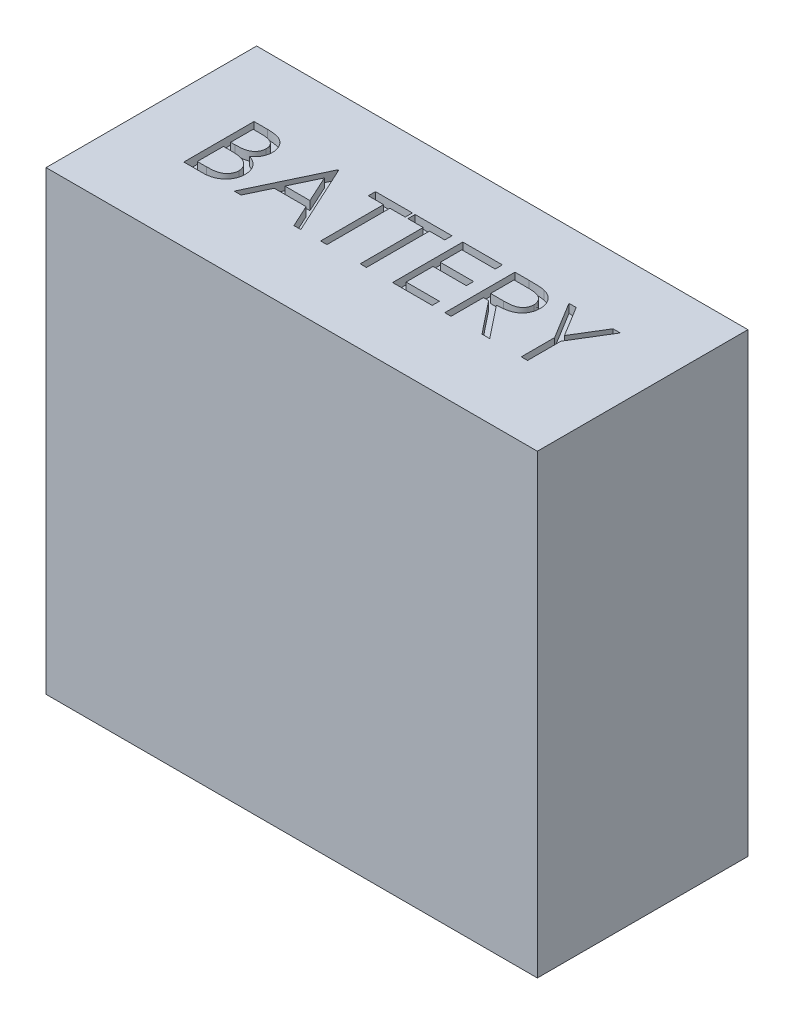
from build123d import *

# Parameters (mm, degrees)
SKETCH2_W           = 177.8
SKETCH2_H           = 165.1
BOSS_EXTRUDE1_DEPTH = 76.2
CUT_EXTRUDE1_DEPTH  = 3.175


with BuildPart() as part:
    # Sketch2 → Boss-Extrude1 (new body)
    with BuildSketch(Plane.XY):
        Rectangle(SKETCH2_W, SKETCH2_H)
    extrude(amount=BOSS_EXTRUDE1_DEPTH)

    # Sketch3 → Cut-Extrude1 (cut)
    # profile 1 of 7: a face of its own
    with BuildSketch(Plane(origin=(0, 82.55, 0), x_dir=(1, 0, 0), z_dir=(0, 1, 0))):
        with BuildLine():
            Line((-65.712217331, -24.131786217), (-60.756367972, -24.131786217))
            add(Edge.make_bspline(
                [(-60.756367972, -24.131786217), (-60.513772731, -24.133061662), (-60.043562776, -24.135533794), (-59.359798826, -24.173874231), (-58.719364601, -24.226152293), (-58.122074367, -24.309102108), (-57.568204127, -24.409191005), (-57.056084702, -24.53039847), (-56.587344595, -24.675734466), (-56.027726451, -24.906847479), (-55.389673655, -25.250278472), (-54.698805319, -25.757760059), (-54.108043125, -26.378481363), (-53.598690994, -27.078669776), (-53.193734297, -27.848912234), (-52.90076854, -28.670850347), (-52.715291387, -29.533882417), (-52.696216464, -30.126378622), (-52.686576306, -30.425816665)],
                knots=[0, 0, 0, 0, 1.001505555, 1.941167018, 2.826882275, 3.653841531, 4.429895133, 5.150066043, 5.825578002, 6.45369114, 7.647487171, 8.808567382, 9.977351308, 11.170798116, 12.373658725, 13.556498008, 14.765093433, 16, 16, 16, 16], degree=3))
            add(Edge.make_bspline(
                [(-52.686576306, -30.425816665), (-52.694509948, -30.706323784), (-52.710100304, -31.257546724), (-52.859182043, -32.063772546), (-53.092576608, -32.831224248), (-53.417008988, -33.557100988), (-53.838663474, -34.225002066), (-54.33837813, -34.840315369), (-54.941278354, -35.376988754), (-55.392986438, -35.677020104), (-55.622433677, -35.829422435)],
                knots=[0, 0, 0, 0, 1.044552857, 2.05264487, 3.044412934, 4.028983338, 5.005914585, 5.980388656, 6.974128949, 8, 8, 8, 8], degree=3))
            add(Edge.make_bspline(
                [(-55.622433677, -35.829422435), (-55.333886574, -35.940202713), (-54.781824488, -36.152152827), (-54.02210314, -36.526878765), (-53.367546265, -36.934455224), (-52.813121263, -37.379549222), (-52.338956567, -37.859310306), (-51.92491522, -38.380773135), (-51.571627533, -38.950740121), (-51.268910888, -39.563268635), (-51.032699915, -40.212104148), (-50.855800495, -40.891160637), (-50.754436721, -41.598003123), (-50.740012125, -42.079045591), (-50.732730152, -42.321890383)],
                knots=[0, 0, 0, 0, 1.27268992, 2.434971085, 3.483601985, 4.442670788, 5.356604649, 6.2567628, 7.179492994, 8.113709626, 9.066344395, 10.018646069, 10.999752585, 12, 12, 12, 12], degree=3))
            add(Edge.make_bspline(
                [(-50.732730152, -42.321890383), (-50.739819263, -42.569844255), (-50.753767288, -43.057700445), (-50.856673369, -43.774380564), (-51.030910888, -44.459273034), (-51.270912922, -45.116807788), (-51.584148005, -45.745712764), (-51.965350946, -46.346700452), (-52.419877151, -46.913732451), (-52.928333399, -47.453109601), (-53.503550112, -47.938088401), (-54.124150162, -48.370002387), (-54.79794917, -48.725210952), (-55.513880783, -49.023595793), (-56.279976106, -49.251522319), (-57.092795028, -49.410980427), (-57.951636533, -49.518422696), (-58.540987298, -49.527256125), (-58.843226947, -49.531786217)],
                knots=[0, 0, 0, 0, 0.978564426, 1.925352924, 2.850884081, 3.763762016, 4.682927383, 5.618979971, 6.567305752, 7.547517671, 8.540179244, 9.531824382, 10.526200242, 11.540722885, 12.589160233, 13.674978461, 14.80764778, 16, 16, 16, 16], degree=3))
            Line((-58.843226947, -49.531786217), (-65.712217331, -49.531786217))
            Line((-65.712217331, -49.531786217), (-65.712217331, -24.131786217))
        make_face()
        with BuildLine():
            Line((-63.432730152, -26.736914422), (-63.432730152, -34.877940063))
            Line((-63.432730152, -34.877940063), (-61.901199703, -34.877940063))
            add(Edge.make_bspline(
                [(-61.901199703, -34.877940063), (-61.677325588, -34.875037764), (-61.244755175, -34.869429932), (-60.618319355, -34.853366123), (-60.036840651, -34.808386036), (-59.501322777, -34.763418877), (-59.012609041, -34.690306156), (-58.57178216, -34.603277606), (-58.171923771, -34.511235952), (-57.710808212, -34.354703105), (-57.187764529, -34.123362262), (-56.630175716, -33.76433808), (-56.138616993, -33.336715631), (-55.723528831, -32.843295508), (-55.383811302, -32.299980902), (-55.147854626, -31.715440684), (-54.987854336, -31.104243155), (-54.973401508, -30.684647834), (-54.966063485, -30.471609935)],
                knots=[0, 0, 0, 0, 1.156816544, 2.235205308, 3.236616184, 4.169592532, 5.011045266, 5.787822928, 6.49130361, 7.128639758, 8.301311294, 9.436451833, 10.541879658, 11.654887649, 12.756523258, 13.837046038, 14.901820046, 16, 16, 16, 16], degree=3))
            add(Edge.make_bspline(
                [(-54.966063485, -30.471609935), (-54.96988205, -30.330634336), (-54.977372582, -30.054095304), (-55.038719406, -29.650965705), (-55.142986947, -29.27182533), (-55.276912389, -28.911478358), (-55.464064587, -28.581192359), (-55.684416578, -28.269547453), (-55.950649873, -27.98715665), (-56.253688656, -27.723218005), (-56.602094091, -27.489214861), (-56.995658323, -27.284267608), (-57.439706036, -27.119234543), (-57.926753613, -26.974700179), (-58.464298076, -26.873185133), (-59.046136264, -26.788614834), (-59.677033939, -26.745560077), (-60.11351554, -26.739860587), (-60.339140408, -26.736914422)],
                knots=[0, 0, 0, 0, 0.91205012, 1.789085906, 2.630437955, 3.453916878, 4.269457761, 5.079663411, 5.91843418, 6.774407191, 7.675494373, 8.627863946, 9.638891023, 10.736472738, 11.911756761, 13.175263542, 14.539845004, 16, 16, 16, 16], degree=3))
            Line((-60.339140408, -26.736914422), (-63.432730152, -26.736914422))
        make_face(mode=Mode.SUBTRACT)
        with BuildLine():
            Line((-63.432730152, -37.483068268), (-63.432730152, -46.926658011))
            Line((-63.432730152, -46.926658011), (-60.186496177, -46.926658011))
            add(Edge.make_bspline(
                [(-60.186496177, -46.926658011), (-59.954130258, -46.923873102), (-59.506275581, -46.918505556), (-58.859655226, -46.900982788), (-58.260337844, -46.861124559), (-57.71105823, -46.798380393), (-57.205885231, -46.730319647), (-56.750879043, -46.63879778), (-56.342351297, -46.533939609), (-55.86864632, -46.371857331), (-55.33522086, -46.120060085), (-54.76037636, -45.74040827), (-54.249283234, -45.288119122), (-53.815267924, -44.764654774), (-53.459573664, -44.19546743), (-53.200816933, -43.592069747), (-53.041226144, -42.96443192), (-53.021906402, -42.536502063), (-53.012217331, -42.321890383)],
                knots=[0, 0, 0, 0, 1.160039823, 2.235823828, 3.228722157, 4.157150951, 4.99529583, 5.772374946, 6.472645482, 7.099169577, 8.269452708, 9.405989375, 10.527446681, 11.663510218, 12.788923519, 13.866172445, 14.929861265, 16, 16, 16, 16], degree=3))
            add(Edge.make_bspline(
                [(-53.012217331, -42.321890383), (-53.01422106, -42.187681569), (-53.018196197, -41.921428741), (-53.078144659, -41.530153939), (-53.165331029, -41.151143316), (-53.278044863, -40.783367714), (-53.442197567, -40.433476354), (-53.633833637, -40.094549207), (-53.858524952, -39.766138242), (-54.208639755, -39.350940746), (-54.717887872, -38.872571567), (-55.441474185, -38.404213693), (-56.264233147, -38.026495322), (-56.86096981, -37.866116265), (-57.169228549, -37.783268588)],
                knots=[0, 0, 0, 0, 0.723448775, 1.435228256, 2.130040452, 2.821711965, 3.505591119, 4.210454504, 4.921174351, 5.648778258, 7.137944449, 8.670945889, 10.280296675, 12, 12, 12, 12], degree=3))
            add(Edge.make_bspline(
                [(-57.169228549, -37.783268588), (-57.292811131, -37.758194551), (-57.560763658, -37.703828865), (-57.99769867, -37.646441531), (-58.49652469, -37.595314525), (-59.058393571, -37.55749641), (-59.684016189, -37.518405494), (-60.374728685, -37.503203078), (-61.12771034, -37.48506559), (-61.650169271, -37.483751073), (-61.921552267, -37.483068268)],
                knots=[0, 0, 0, 0, 0.634451884, 1.375622551, 2.216452059, 3.157844607, 4.20941857, 5.370758133, 6.634282058, 8, 8, 8, 8], degree=3))
            Line((-61.921552267, -37.483068268), (-63.432730152, -37.483068268))
        make_face(mode=Mode.SUBTRACT)
    # profile 2 of 7: a face of its own
    with BuildSketch(Plane(origin=(0, 82.55, 0), x_dir=(1, 0, 0), z_dir=(0, 1, 0))):
        Polygon((-35.101960921, -24.131786217), (-23.378883998, -49.531786217), (-25.856808677, -49.531786217), (-29.611856754, -41.390760576), (-41.126319895, -41.390760576), (-44.988218934, -49.531786217), (-47.476319895, -49.531786217), (-35.427601947, -24.131786217), align=None)
        Polygon((-35.290222139, -29.082547435), (-39.889901626, -38.78563237), (-30.812658036, -38.78563237), align=None, mode=Mode.SUBTRACT)
    # profile 3 of 7: a face of its own
    with BuildSketch(Plane(origin=(0, 82.55, 0), x_dir=(1, 0, 0), z_dir=(0, 1, 0))):
        Polygon((-21.75067887, -26.736914422), (-21.75067887, -24.131786217), (-8.399396818, -24.131786217), (-8.399396818, -26.736914422), (-13.935294254, -26.736914422), (-13.935294254, -49.531786217), (-16.214781434, -49.531786217), (-16.214781434, -26.736914422), align=None)
    # profile 4 of 7: a face of its own
    with BuildSketch(Plane(origin=(0, 82.55, 0), x_dir=(1, 0, 0), z_dir=(0, 1, 0))):
        Polygon((-7.422473742, -26.736914422), (-7.422473742, -24.131786217), (5.92880831, -24.131786217), (5.92880831, -26.736914422), (0.392910874, -26.736914422), (0.392910874, -49.531786217), (-1.886576306, -49.531786217), (-1.886576306, -26.736914422), align=None)
    # profile 5 of 7: a face of its own
    with BuildSketch(Plane(origin=(0, 82.55, 0), x_dir=(1, 0, 0), z_dir=(0, 1, 0))):
        Polygon((9.836500617, -24.131786217), (24.164705746, -24.131786217), (24.164705746, -26.736914422), (12.115987797, -26.736914422), (12.115987797, -34.552299037), (24.164705746, -34.552299037), (24.164705746, -37.157427242), (12.115987797, -37.157427242), (12.115987797, -46.926658011), (24.164705746, -46.926658011), (24.164705746, -49.531786217), (9.836500617, -49.531786217), align=None)
    # profile 6 of 7: a face of its own
    with BuildSketch(Plane(origin=(0, 82.55, 0), x_dir=(1, 0, 0), z_dir=(0, 1, 0))):
        with BuildLine():
            Line((28.723680105, -24.131786217), (33.806732989, -24.131786217))
            add(Edge.make_bspline(
                [(33.806732989, -24.131786217), (34.145940036, -24.132915326), (34.797255141, -24.135083342), (35.730329732, -24.147172022), (36.578160664, -24.181820203), (37.340304641, -24.21163678), (38.01674768, -24.266006869), (38.609564019, -24.317972708), (39.116023309, -24.385998703), (39.422607487, -24.449175201), (39.561420489, -24.477779806)],
                knots=[0, 0, 0, 0, 1.410062039, 2.707475311, 3.878576406, 4.937260626, 5.877586885, 6.699081471, 7.410979367, 8, 8, 8, 8], degree=3))
            add(Edge.make_bspline(
                [(39.561420489, -24.477779806), (39.747251419, -24.523694046), (40.114948999, -24.614543051), (40.64435805, -24.806564154), (41.14883343, -25.028775144), (41.626279583, -25.289769), (42.074305039, -25.591483116), (42.497529352, -25.928708919), (42.897873, -26.299601212), (43.259145402, -26.713511205), (43.599788806, -27.147753303), (43.887089124, -27.61731771), (44.134749863, -28.108347081), (44.331930186, -28.625835199), (44.490701765, -29.164763486), (44.602652188, -29.730013611), (44.669789378, -30.319010401), (44.676624558, -30.720750654), (44.680090361, -30.924454486)],
                knots=[0, 0, 0, 0, 1.027469482, 2.033020251, 3.019912614, 3.986113645, 4.951240523, 5.91722682, 6.890402269, 7.87763091, 8.8651537, 9.85103654, 10.82876324, 11.815024772, 12.821070561, 13.842952187, 14.906261191, 16, 16, 16, 16], degree=3))
            add(Edge.make_bspline(
                [(44.680090361, -30.924454486), (44.669429632, -31.262892102), (44.648627788, -31.923271549), (44.454679893, -32.881656231), (44.136987435, -33.775658686), (43.699212709, -34.604153258), (43.1417228, -35.350990513), (42.471708602, -36.00696696), (41.688796335, -36.555896612), (40.959966443, -36.936554109), (40.316154822, -37.180342646), (39.786141638, -37.351875078), (39.207987001, -37.484404769), (38.587230344, -37.603132583), (37.921288387, -37.692770594), (37.211757244, -37.758423022), (36.458130887, -37.799455261), (35.940413069, -37.805565811), (35.674080746, -37.808709294)],
                knots=[0, 0, 0, 0, 1.260483769, 2.459530307, 3.627416485, 4.787058657, 5.939039949, 7.08810263, 8.267026773, 9.491475466, 10.141966685, 10.831826277, 11.566392101, 12.351337768, 13.187381173, 14.07005841, 15.007169909, 16, 16, 16, 16], degree=3))
            Line((35.674080746, -37.808709294), (45.005731387, -49.531786217))
            Line((45.005731387, -49.531786217), (42.186901258, -49.531786217))
            Line((42.186901258, -49.531786217), (32.855250617, -37.808709294))
            Line((32.855250617, -37.808709294), (31.003167284, -37.808709294))
            Line((31.003167284, -37.808709294), (31.003167284, -49.531786217))
            Line((31.003167284, -49.531786217), (28.723680105, -49.531786217))
            Line((28.723680105, -49.531786217), (28.723680105, -24.131786217))
        make_face()
        with BuildLine():
            Line((31.003167284, -26.736914422), (31.003167284, -35.203581088))
            Line((31.003167284, -35.203581088), (35.653728182, -35.239198076))
            add(Edge.make_bspline(
                [(35.653728182, -35.239198076), (35.870862178, -35.239294136), (36.291729707, -35.239480328), (36.900608817, -35.210496923), (37.467537628, -35.177525414), (37.990347658, -35.12709302), (38.469272462, -35.062097529), (38.904072661, -34.980795871), (39.295458009, -34.886075188), (39.751921687, -34.739469104), (40.261638229, -34.507196857), (40.815586538, -34.169264381), (41.287317789, -33.744219916), (41.685864561, -33.258183978), (42.00611815, -32.723795201), (42.231902773, -32.147459264), (42.375176497, -31.543725953), (42.392075084, -31.128776256), (42.400603182, -30.919366345)],
                knots=[0, 0, 0, 0, 1.146690395, 2.22261258, 3.21895312, 4.145990853, 4.996080663, 5.770904154, 6.481378293, 7.121626537, 8.300444488, 9.431385265, 10.535395872, 11.636531494, 12.74115979, 13.810798291, 14.895190096, 16, 16, 16, 16], degree=3))
            add(Edge.make_bspline(
                [(42.400603182, -30.919366345), (42.391879217, -30.715102638), (42.374591503, -30.310326506), (42.233449011, -29.7177379), (41.994766072, -29.158452033), (41.67311326, -28.634744057), (41.281233678, -28.159359574), (40.821727266, -27.752617377), (40.307158135, -27.416978405), (39.826218582, -27.202498043), (39.39634744, -27.07099968), (39.02311505, -26.978462663), (38.601391754, -26.904117088), (38.129129854, -26.844550018), (37.608345448, -26.793351279), (37.036405295, -26.758866943), (36.417104089, -26.738446329), (35.98786636, -26.737436941), (35.765667284, -26.736914422)],
                knots=[0, 0, 0, 0, 1.101028733, 2.181837193, 3.264309656, 4.369019818, 5.486613113, 6.575447106, 7.666700264, 8.788928104, 9.402425223, 10.0903467, 10.862060571, 11.710948788, 12.657782767, 13.684531032, 14.801375019, 16, 16, 16, 16], degree=3))
            Line((35.765667284, -26.736914422), (31.003167284, -26.736914422))
        make_face(mode=Mode.SUBTRACT)
    # profile 7 of 7: a face of its own
    with BuildSketch(Plane(origin=(0, 82.55, 0), x_dir=(1, 0, 0), z_dir=(0, 1, 0))):
        Polygon((48.262141643, -24.131786217), (50.872357989, -24.131786217), (57.547999015, -35.045848717), (64.213463758, -24.131786217), (66.823680105, -24.131786217), (58.682654464, -37.457627563), (58.682654464, -49.531786217), (56.403167284, -49.531786217), (56.403167284, -37.457627563), align=None)
    extrude(amount=-CUT_EXTRUDE1_DEPTH, mode=Mode.SUBTRACT)


solid = part.part
